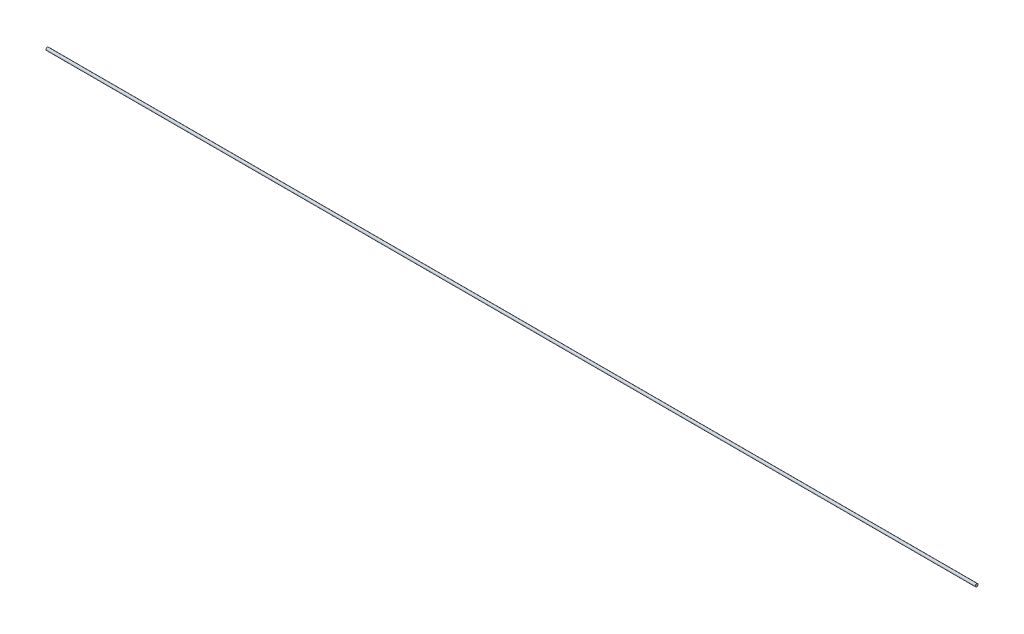
from build123d import *

# Parameters (mm, degrees)
CABLE_SKETCH_W = 797.248142171
CABLE_SKETCH_H = 1.19


with BuildPart() as part:
    # Cable Sketch → Cable (revolve)
    with BuildSketch(Plane.XY):
        with Locations((410.624071086, 0.595)):
            Rectangle(CABLE_SKETCH_W, CABLE_SKETCH_H)
    revolve(axis=Axis((-3000, 0, 0), (1, 0, 0)))


solid = part.part
